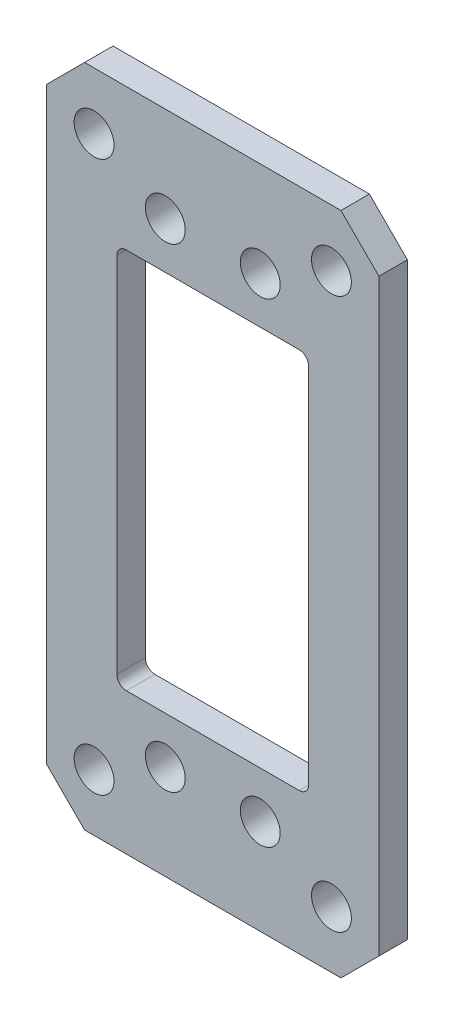
from build123d import *

# Parameters (mm, degrees)
SKETCH_1_W                  = 35
SKETCH_1_H                  = 70
EXTRUDE_1_DEPTH             = 3
CHAMFER_1_SIZE              = 4
SKETCH_2_W                  = 20.2
SKETCH_2_H                  = 40.2
CUT_EXTRUDE_1_DEPTH         = 40.246018906
SKETCH_4_R                  = 2.1
CUT_EXTRUDE_3_DEPTH         = 40.246018906
PATTERN_LINEAR_2_COUNT      = 2
PATTERN_LINEAR_2_PITCH      = 25
PATTERN_LINEAR_2_COUNT_DIR2 = 2
PATTERN_LINEAR_2_PITCH_DIR2 = 58
SKETCH_5_R                  = 2.1
CUT_EXTRUDE_4_DEPTH         = 40.246018906
PATTERN_LINEAR_3_COUNT      = 2
PATTERN_LINEAR_3_PITCH      = 10
PATTERN_LINEAR_3_COUNT_DIR2 = 2
PATTERN_LINEAR_3_PITCH_DIR2 = 50
FILLET_1_R                  = 1


with BuildPart() as part:
    # 草圖1 → 填料-伸長1 (new body)
    with BuildSketch(Plane.XY):
        Rectangle(SKETCH_1_W, SKETCH_1_H)
    extrude(amount=EXTRUDE_1_DEPTH)

    # 導角1
    chamfer_1_edges = [part.edges().sort_by_distance(p)[0] for p in [
        (17.5, -35, 1.5),
        (-17.5, -35, 1.5),
        (-17.5, 35, 1.5),
        (17.5, 35, 1.5),
    ]]
    chamfer(chamfer_1_edges, length=CHAMFER_1_SIZE)

    # 草圖2 → 除料-伸長1 (cut, through all)
    with BuildSketch(Plane(origin=(0, 0, 0), x_dir=(-1, 0, 0), z_dir=(0, 0, -1))):
        Rectangle(SKETCH_2_W, SKETCH_2_H)
    extrude(amount=-CUT_EXTRUDE_1_DEPTH, mode=Mode.SUBTRACT)

    # 草圖4 → 除料-伸長3 (cut, through all)
    with BuildSketch(Plane(origin=(0, 0, 0), x_dir=(-1, 0, 0), z_dir=(0, 0, -1))):
        with Locations((-12.5, 29)):
            Circle(SKETCH_4_R)
    cut_extrude_3 = extrude(amount=-CUT_EXTRUDE_3_DEPTH, mode=Mode.SUBTRACT)

    # 直線複製排列2: Cut-Extrude 3 2 × 2
    with Locations(*[(-i * PATTERN_LINEAR_2_PITCH, -j * PATTERN_LINEAR_2_PITCH_DIR2, 0) for i in range(PATTERN_LINEAR_2_COUNT) for j in range(PATTERN_LINEAR_2_COUNT_DIR2) if (i, j) != (0, 0)]):
        add(cut_extrude_3, mode=Mode.SUBTRACT)

    # 草圖5 → 除料-伸長4 (cut, symmetric)
    with BuildSketch(Plane.XY.offset(3)):
        with Locations((-5, -25)):
            Circle(SKETCH_5_R)
    cut_extrude_4 = extrude(amount=CUT_EXTRUDE_4_DEPTH, both=True, mode=Mode.SUBTRACT)

    # 直線複製排列3: Cut-Extrude 4 2 × 2
    with Locations(*[(i * PATTERN_LINEAR_3_PITCH, j * PATTERN_LINEAR_3_PITCH_DIR2, 0) for i in range(PATTERN_LINEAR_3_COUNT) for j in range(PATTERN_LINEAR_3_COUNT_DIR2) if (i, j) != (0, 0)]):
        add(cut_extrude_4, mode=Mode.SUBTRACT)

    # 圓角1
    fillet_1_edges = [part.edges().sort_by_distance(p)[0] for p in [
        (-10.1, 20.1, 1.5),
        (-10.1, -20.1, 1.5),
        (10.1, -20.1, 1.5),
        (10.1, 20.1, 1.5),
    ]]
    fillet(fillet_1_edges, radius=FILLET_1_R)


solid = part.part
